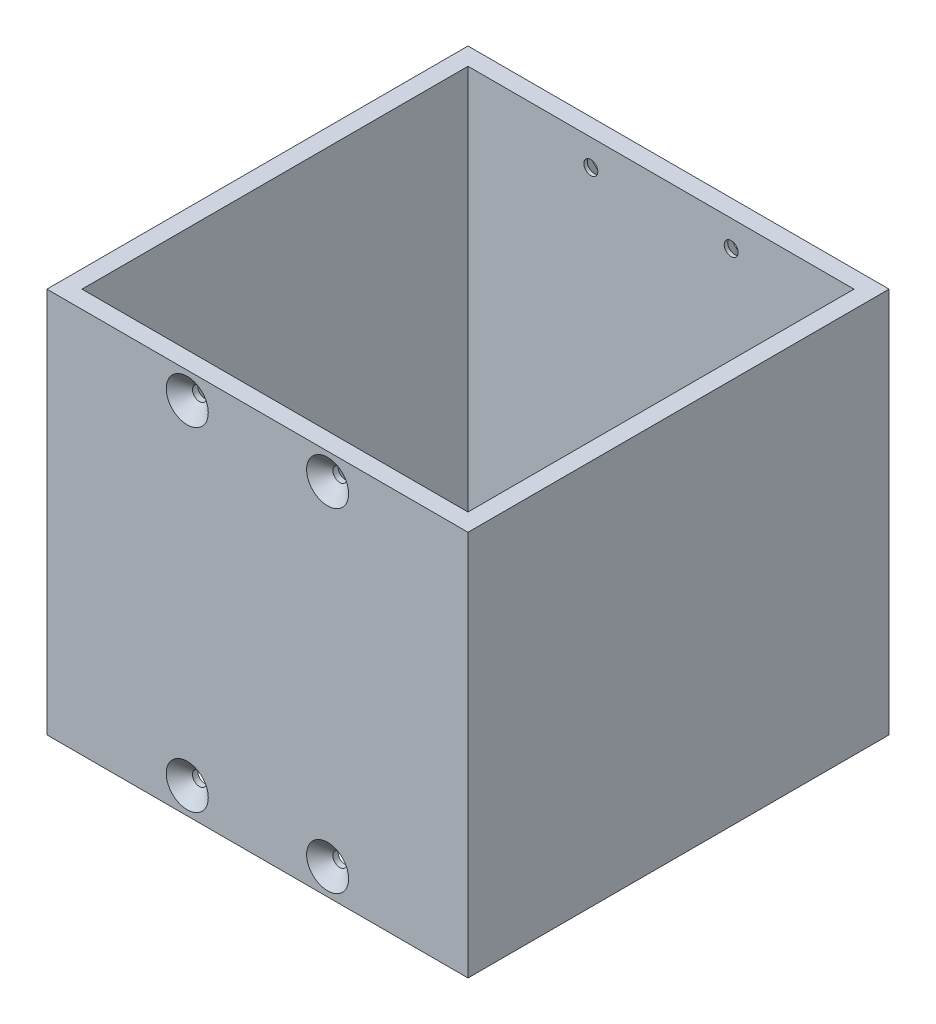
from build123d import *
from OCP.BRepFilletAPI import BRepFilletAPI_MakeChamfer

# Parameters (mm, degrees)
SKETCH1_W           = 76.2
SKETCH1_H           = 76.2
SKETCH1_W_2         = 69.85
SKETCH1_H_2         = 69.85
BOSS_EXTRUDE1_DEPTH = 9.525
SKETCH2_R           = 1.26365
CUT_EXTRUDE1_DEPTH  = 86.725
CHAMFER1_SIZE       = 2.54
CHAMFER1_SIZE2      = 2.207988314
SKETCH3_W           = 76.2
SKETCH3_H           = 76.2
SKETCH3_W_2         = 69.85
SKETCH3_H_2         = 69.85
BOSS_EXTRUDE2_DEPTH = 25.4


with BuildPart() as part:
    # Sketch1 → Boss-Extrude1 (new body)
    with BuildSketch(Plane(origin=(0, 0, 0), x_dir=(1, 0, 0), z_dir=(0, 1, 0))):
        Rectangle(SKETCH1_W, SKETCH1_H)
        Rectangle(SKETCH1_W_2, SKETCH1_H_2, mode=Mode.SUBTRACT)
    extrude(amount=BOSS_EXTRUDE1_DEPTH)

    # Sketch2 → Cut-Extrude1 (cut, through all)
    with BuildSketch(Plane.XY.offset(38.1)):
        with Locations((-12.7, 4.7625)):
            Circle(SKETCH2_R)
        with Locations((12.7, 4.7625)):
            Circle(SKETCH2_R)
    extrude(amount=-CUT_EXTRUDE1_DEPTH, mode=Mode.SUBTRACT)

    # Chamfer1: one chamfer whose edges measure the first distance from different faces: ONE call of the kernel's chamfer builder (chamfer() names one face for all edges)
    chamfer1_edges_1 = [part.edges().sort_by_distance(p)[0] for p in [
        (-13.96365, 4.7625, -38.1),
    ]]
    chamfer1_side_1 = [part.faces().sort_by_distance(p)[0] for p in [
        (-13.96365, 4.7625, -36.5125),
    ]]
    chamfer1_edges_2 = [part.edges().sort_by_distance(p)[0] for p in [
        (11.43635, 4.7625, -38.1),
    ]]
    chamfer1_side_2 = [part.faces().sort_by_distance(p)[0] for p in [
        (11.43635, 4.7625, -36.5125),
    ]]
    chamfer1_edges_3 = [part.edges().sort_by_distance(p)[0] for p in [
        (11.43635, 4.7625, 38.1),
        (-13.96365, 4.7625, 38.1),
    ]]
    chamfer1_side_3 = [part.faces().sort_by_distance(p)[0] for p in [
        (0, 4.7625, 38.1),
    ]]
    chamfer1 = BRepFilletAPI_MakeChamfer(part.part.solid().wrapped)
    for e in chamfer1_edges_1:
        chamfer1.Add(CHAMFER1_SIZE, CHAMFER1_SIZE2, e.wrapped, chamfer1_side_1[0].wrapped)  # the first distance lies on this face
    for e in chamfer1_edges_2:
        chamfer1.Add(CHAMFER1_SIZE, CHAMFER1_SIZE2, e.wrapped, chamfer1_side_2[0].wrapped)  # the first distance lies on this face
    for e in chamfer1_edges_3:
        chamfer1.Add(CHAMFER1_SIZE, CHAMFER1_SIZE2, e.wrapped, chamfer1_side_3[0].wrapped)  # the first distance lies on this face
    add(Compound.cast(chamfer1.Shape()), mode=Mode.REPLACE)

    # Sketch3 → Boss-Extrude2 (add)
    with BuildSketch(Plane(origin=(0, 9.525, 0), x_dir=(1, 0, 0), z_dir=(0, 1, 0))):
        Rectangle(SKETCH3_W, SKETCH3_H)
        Rectangle(SKETCH3_W_2, SKETCH3_H_2, mode=Mode.SUBTRACT)
    extrude(amount=BOSS_EXTRUDE2_DEPTH)

    # Mirror2: part across plane


with BuildPart() as part_1:
    add(part.part)
    add(part.part.mirror(Plane.ZX.offset(34.925)))


solid = part_1.part
